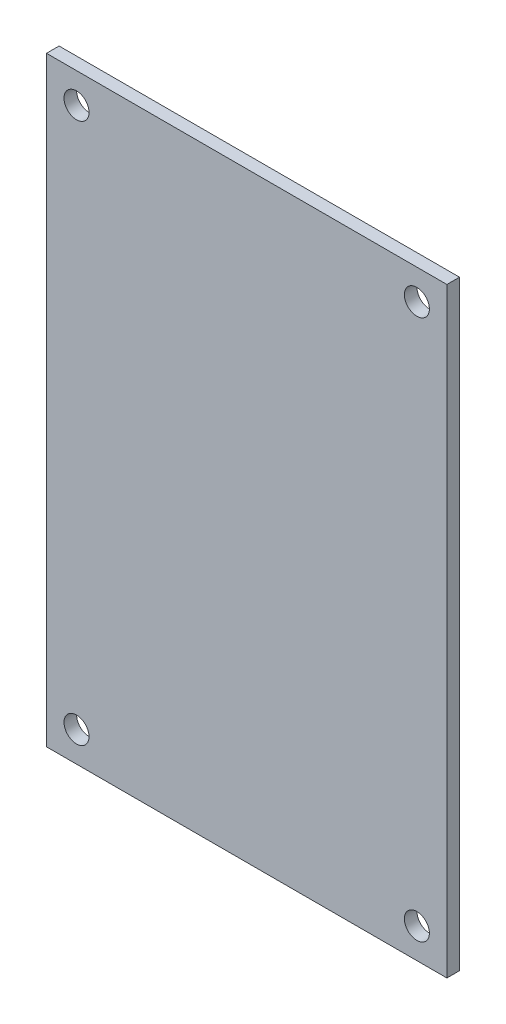
from build123d import *

# Parameters (mm, degrees)
SKETCH1_W           = 50.8
SKETCH1_H           = 76.2
BOSS_EXTRUDE1_DEPTH = 1.6002
CUT_EXTRUDE1_REACH  = 47.818
SKETCH2_R           = 1.5875


with BuildPart() as part:
    # Sketch1 → Boss-Extrude1 (new body)
    with BuildSketch(Plane.XY):
        Rectangle(SKETCH1_W, SKETCH1_H)
    extrude(amount=BOSS_EXTRUDE1_DEPTH)

    # Sketch2 → Cut-Extrude1 (cut, up to next)
    with BuildSketch(Plane.XY.offset(1.6002), mode=Mode.PRIVATE) as cut_extrude1_sk1:
        with Locations((-21.59, 34.29)):
            Circle(SKETCH2_R)
    cut_extrude1_tool1 = extrude(cut_extrude1_sk1.sketch, amount=-CUT_EXTRUDE1_REACH, mode=Mode.PRIVATE) & part.part
    # Sketch2 → Cut-Extrude1 (cut, up to next)
    with BuildSketch(Plane.XY.offset(1.6002), mode=Mode.PRIVATE) as cut_extrude1_sk2:
        with Locations((21.59, 34.29)):
            Circle(SKETCH2_R)
    cut_extrude1_tool2 = extrude(cut_extrude1_sk2.sketch, amount=-CUT_EXTRUDE1_REACH, mode=Mode.PRIVATE) & part.part
    # Sketch2 → Cut-Extrude1 (cut, up to next)
    with BuildSketch(Plane.XY.offset(1.6002), mode=Mode.PRIVATE) as cut_extrude1_sk3:
        with Locations((21.59, -34.29)):
            Circle(SKETCH2_R)
    cut_extrude1_tool3 = extrude(cut_extrude1_sk3.sketch, amount=-CUT_EXTRUDE1_REACH, mode=Mode.PRIVATE) & part.part
    # Sketch2 → Cut-Extrude1 (cut, up to next)
    with BuildSketch(Plane.XY.offset(1.6002), mode=Mode.PRIVATE) as cut_extrude1_sk4:
        with Locations((-21.59, -34.29)):
            Circle(SKETCH2_R)
    cut_extrude1_tool4 = extrude(cut_extrude1_sk4.sketch, amount=-CUT_EXTRUDE1_REACH, mode=Mode.PRIVATE) & part.part
    add(cut_extrude1_tool1.solids().sort_by_distance((-21.59, 34.29, 1.6002))[0], mode=Mode.SUBTRACT)
    add(cut_extrude1_tool2.solids().sort_by_distance((21.59, 34.29, 1.6002))[0], mode=Mode.SUBTRACT)
    add(cut_extrude1_tool3.solids().sort_by_distance((21.59, -34.29, 1.6002))[0], mode=Mode.SUBTRACT)
    add(cut_extrude1_tool4.solids().sort_by_distance((-21.59, -34.29, 1.6002))[0], mode=Mode.SUBTRACT)


solid = part.part
